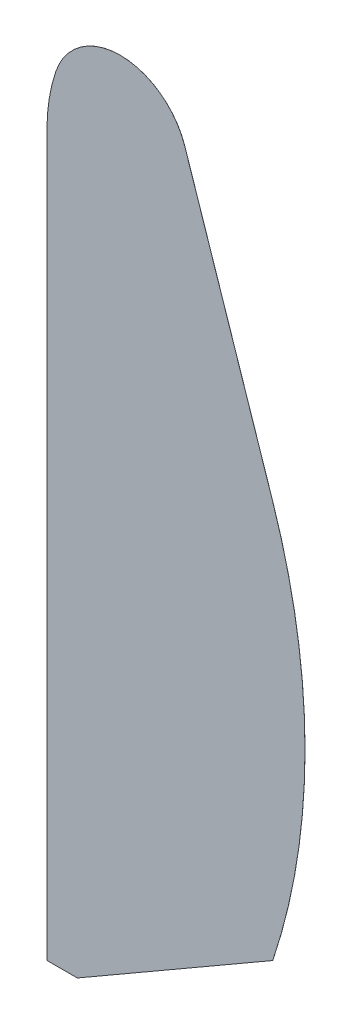
from build123d import *

# Parameters (mm, degrees)
BOSS_EXTRUDE1_DEPTH = 0.01


with BuildPart() as part:
    # Sketch1 → Boss-Extrude1 (new body)
    with BuildSketch(Plane(origin=(0, 0, 0), x_dir=(0, 1, 0), z_dir=(0, 0, 1))):
        with BuildLine():
            Line((0, 0), (118.575, 0))
            ThreePointArc((118.575, 0), (123.095901267, -0.364515296), (127.5, -1.448643526))
            ThreePointArc((127.5, -1.448643526), (135.157510819, -12.073643526), (127.5, -22.698643526))
            Line((127.5, -22.698643526), (84.043406413, -37.1875))
            ThreePointArc((84.043406413, -37.1875), (51.313434101, -42.5), (18.58346179, -37.1875))
            Line((18.58346179, -37.1875), (0, -5))
            Line((0, -5), (0, 0))
        make_face()
    extrude(amount=BOSS_EXTRUDE1_DEPTH)


solid = part.part
